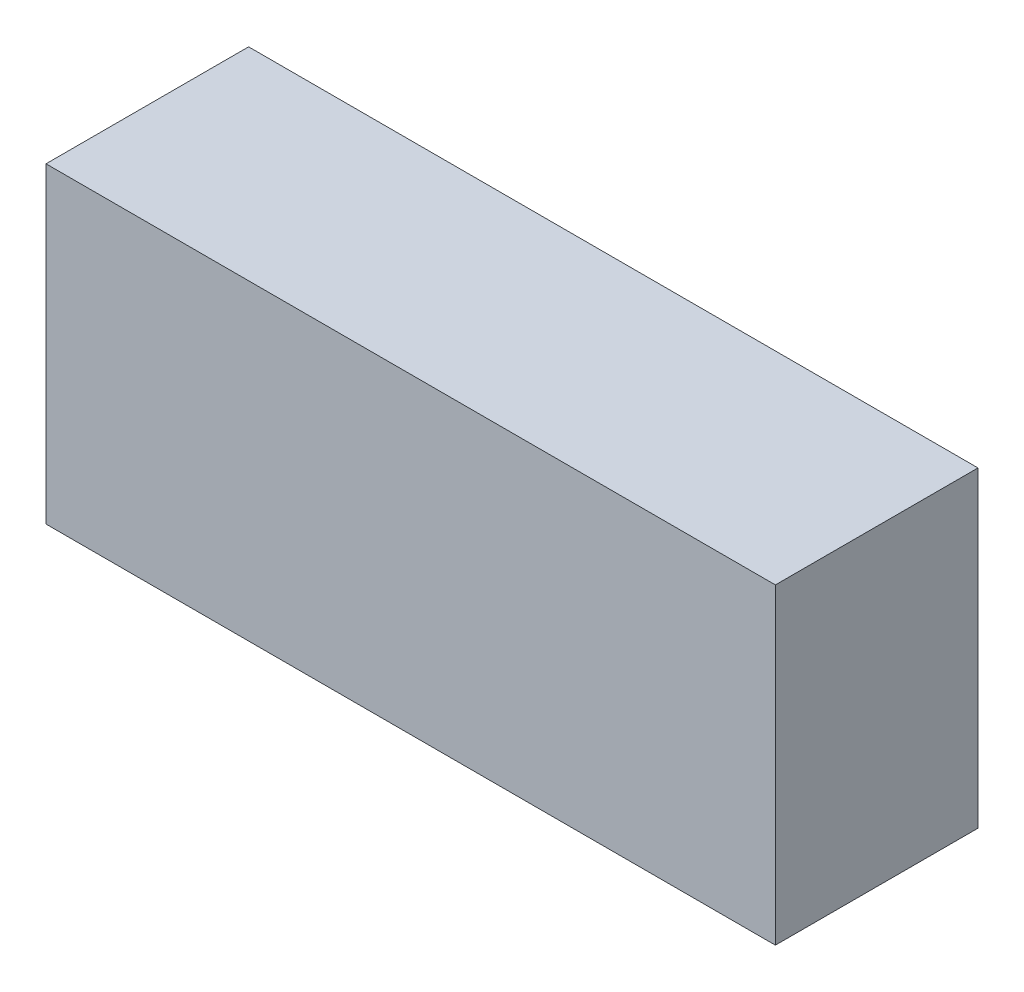
from build123d import *

# Parameters (mm, degrees)
SKETCH_1_W      = 90
SKETCH_1_H      = 25
EXTRUDE_1_DEPTH = 38.5


with BuildPart() as part:
    # 草图1 → 凸台-拉伸1 (new body)
    with BuildSketch(Plane(origin=(0, 0, 0), x_dir=(1, 0, 0), z_dir=(0, 1, 0))):
        Rectangle(SKETCH_1_W, SKETCH_1_H)
    extrude(amount=EXTRUDE_1_DEPTH)


solid = part.part
